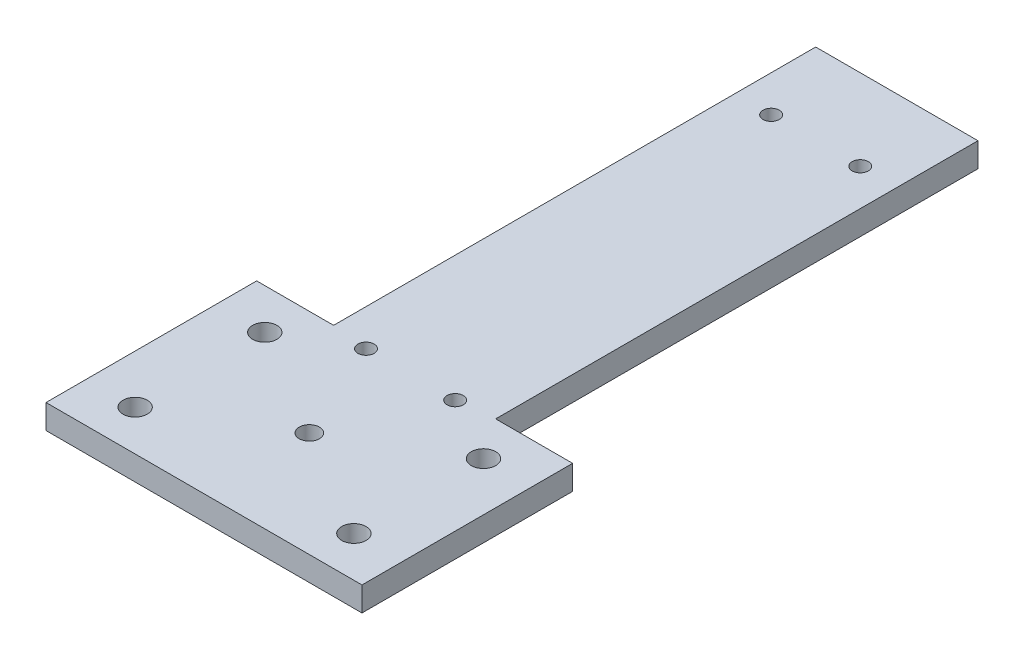
from build123d import *

# Parameters (mm, degrees)
SKETCH2_R           = 2.5
SKETCH2_R_2         = 3
SKETCH2_R_3         = 2
BOSS_EXTRUDE1_DEPTH = 6


with BuildPart() as part:
    # Sketch2 → Boss-Extrude1 (new body)
    with BuildSketch(Plane(origin=(0, 1180.436182905, 0), x_dir=(1, 0, 0), z_dir=(0, 1, 0))):
        Polygon((791.275007127, -1801.911067916), (791.275007127, -1920.911067916), (772.275007127, -1920.911067916), (772.275007127, -1972.911067916), (850.275007127, -1972.911067916), (850.275007127, -1920.911041247), (831.275007127, -1920.911049835), (831.340606325, -1801.911067916), align=None)
        with Locations(Location((811.275007127, -1946.911067916, 0), (0, 0, 270))):
            Circle(SKETCH2_R, mode=Mode.SUBTRACT)
        with Locations(Location((784.275007127, -1930.911067916, 0), (0, 0, 270))):
            Circle(SKETCH2_R_2, mode=Mode.SUBTRACT)
        with Locations(Location((784.275007127, -1962.911067916, 0), (0, 0, 270))):
            Circle(SKETCH2_R_2, mode=Mode.SUBTRACT)
        with Locations(Location((838.275007127, -1930.911067916, 0), (0, 0, 270))):
            Circle(SKETCH2_R_2, mode=Mode.SUBTRACT)
        with Locations(Location((838.275007127, -1962.911067916, 0), (0, 0, 270))):
            Circle(SKETCH2_R_2, mode=Mode.SUBTRACT)
        with Locations(Location((800.275007127, -1921.911067916, 0), (0, 0, 270))):
            Circle(SKETCH2_R_3, mode=Mode.SUBTRACT)
        with Locations(Location((800.275007127, -1821.911067916, 0), (0, 0, 270))):
            Circle(SKETCH2_R_3, mode=Mode.SUBTRACT)
        with Locations(Location((822.275007127, -1921.911067916, 0), (0, 0, 270))):
            Circle(SKETCH2_R_3, mode=Mode.SUBTRACT)
        with Locations(Location((822.275007127, -1821.911067916, 0), (0, 0, 270))):
            Circle(SKETCH2_R_3, mode=Mode.SUBTRACT)
    extrude(amount=BOSS_EXTRUDE1_DEPTH)


solid = part.part
